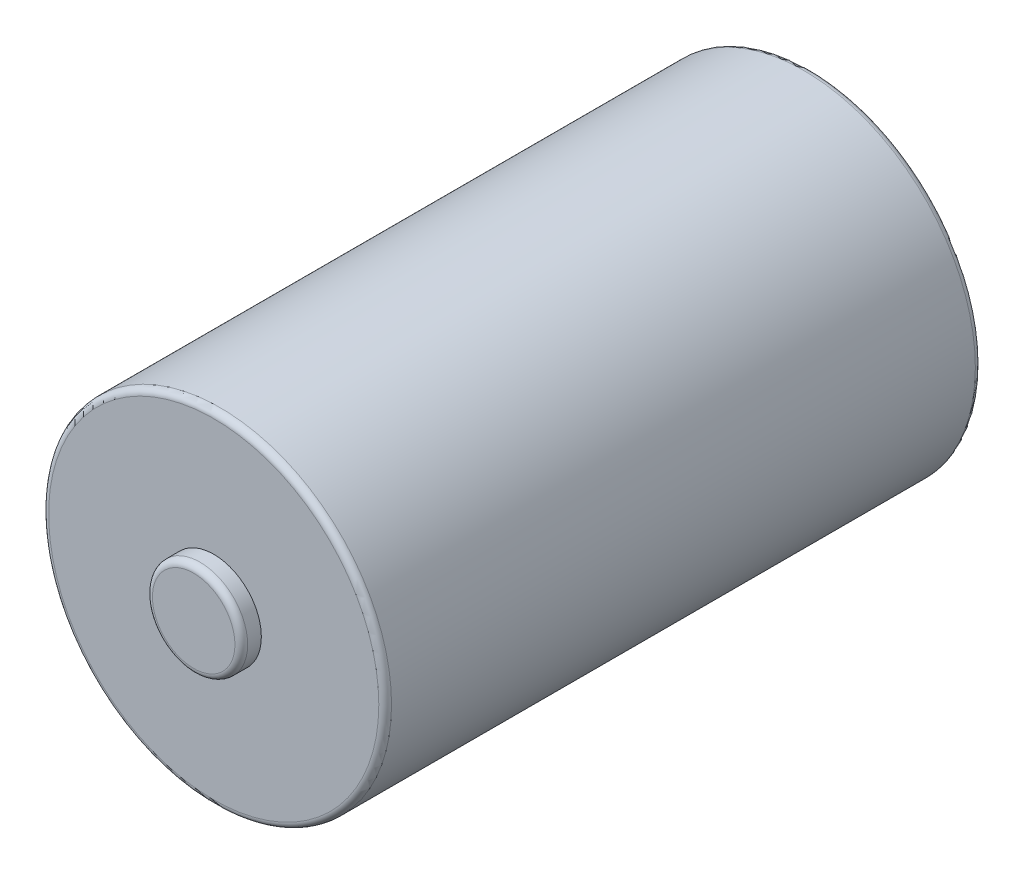
from build123d import *

# Parameters (mm, degrees)
SKETCH1_R           = 17.1
BOSS_EXTRUDE1_DEPTH = 59.5
SKETCH2_R           = 4.75
BOSS_EXTRUDE2_DEPTH = 2
FILLET1_R           = 0.635
FILLET2_R           = 0.635


with BuildPart() as part:
    # Sketch1 → Boss-Extrude1 (new body)
    with BuildSketch(Plane.XY):
        with Locations(Location((0, 0, 0), (0, 0, 180))):
            Circle(SKETCH1_R)
    extrude(amount=BOSS_EXTRUDE1_DEPTH)

    # Sketch2 → Boss-Extrude2 (add)
    with BuildSketch(Plane.XY.offset(59.5)):
        Circle(SKETCH2_R)
    extrude(amount=BOSS_EXTRUDE2_DEPTH)

    # Fillet1
    fillet1_edges = [part.edges().sort_by_distance(p)[0] for p in [
        (17.1, 0, 59.5),
        (-4.75, 0, 61.5),
    ]]
    fillet(fillet1_edges, radius=FILLET1_R)

    # Fillet2
    fillet2_edges = [part.edges().sort_by_distance(p)[0] for p in [
        (17.1, 0, 0),
    ]]
    fillet(fillet2_edges, radius=FILLET2_R)


solid = part.part
